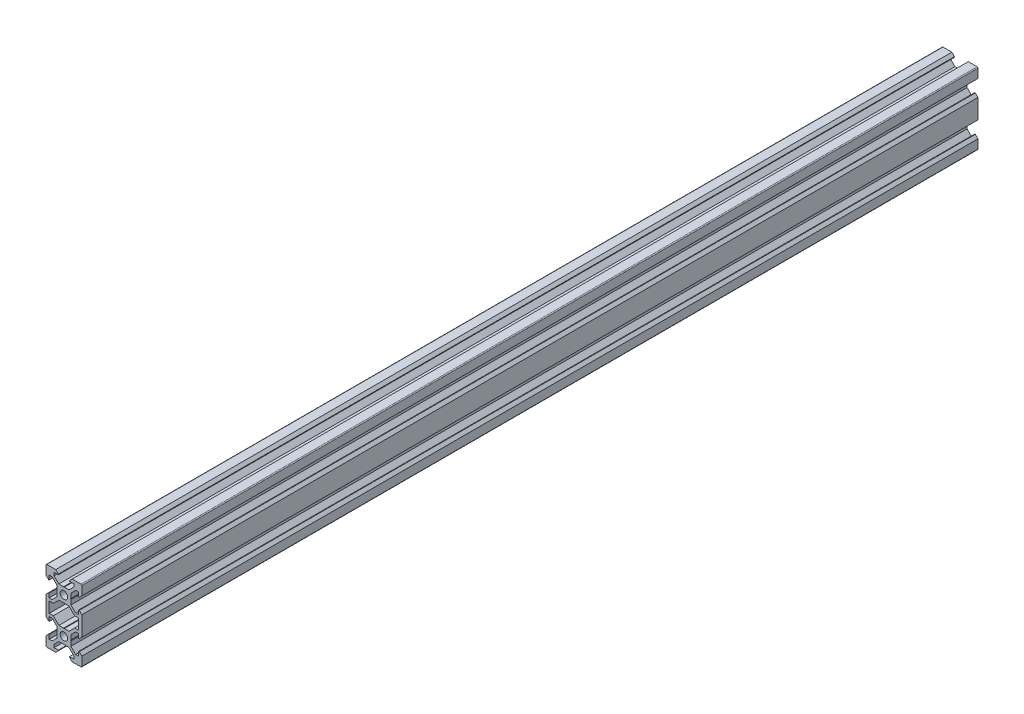
from build123d import *

# Parameters (mm, degrees)
SKETCH1_R           = 2.1
BOSS_EXTRUDE1_DEPTH = 500
FILLET1_R           = 0.5


with BuildPart() as part:
    # Sketch1 → Boss-Extrude1 (new body)
    with BuildSketch(Plane.XY):
        Polygon((2.839339828, 13.9), (5.5, 16.560660172), (5.5, 18.2), (3.125, 18.2), (3.125, 18.545), (4.58, 20), (10, 20), (10, 14.58), (8.545, 13.125), (8.2, 13.125), (8.2, 15.5), (6.560660172, 15.5), (3.9, 12.839339828), (3.9, 10.2), (3.7, 10), (3.9, 9.8), (3.9, 7.160660172), (6.560660172, 4.5), (8.2, 4.5), (8.2, 6.875), (8.545, 6.875), (10, 5.42), (10, -5.42), (8.545, -6.875), (8.2, -6.875), (8.2, -4.5), (6.560660172, -4.5), (3.9, -7.160660172), (3.9, -9.8), (3.7, -10), (3.9, -10.2), (3.9, -12.839339828), (6.560660172, -15.5), (8.2, -15.5), (8.2, -13.125), (8.545, -13.125), (10, -14.58), (10, -20), (4.58, -20), (3.125, -18.545), (3.125, -18.2), (5.5, -18.2), (5.5, -16.560660172), (2.839339828, -13.9), (0.2, -13.9), (0, -13.7), (-0.2, -13.9), (-2.839339828, -13.9), (-5.5, -16.560660172), (-5.5, -18.2), (-3.125, -18.2), (-3.125, -18.545), (-4.58, -20), (-10, -20), (-10, -14.58), (-8.545, -13.125), (-8.2, -13.125), (-8.2, -15.5), (-6.560660172, -15.5), (-3.9, -12.839339828), (-3.9, -10.2), (-3.7, -10), (-3.9, -9.8), (-3.9, -7.160660172), (-6.560660172, -4.5), (-8.2, -4.5), (-8.2, -6.875), (-8.545, -6.875), (-10, -5.42), (-10, 5.42), (-8.545, 6.875), (-8.2, 6.875), (-8.2, 4.5), (-6.560660172, 4.5), (-3.9, 7.160660172), (-3.9, 9.8), (-3.7, 10), (-3.9, 10.2), (-3.9, 12.839339828), (-6.560660172, 15.5), (-8.2, 15.5), (-8.2, 13.125), (-8.545, 13.125), (-10, 14.58), (-10, 20), (-4.58, 20), (-3.125, 18.545), (-3.125, 18.2), (-5.5, 18.2), (-5.5, 16.560660172), (-2.839339828, 13.9), (-0.2, 13.9), (0, 13.7), (0.2, 13.9), align=None)
        with Locations((0, 10)):
            Circle(SKETCH1_R, mode=Mode.SUBTRACT)
        with Locations((0, -10)):
            Circle(SKETCH1_R, mode=Mode.SUBTRACT)
        Polygon((8.2, -3), (8.2, 3), (5.939339828, 3), (2.839339828, 6.1), (0.2, 6.1), (0, 6.3), (-0.2, 6.1), (-2.839339828, 6.1), (-5.939339828, 3), (-8.2, 3), (-8.2, -3), (-5.939339828, -3), (-2.839339828, -6.1), (-0.2, -6.1), (0, -6.3), (0.2, -6.1), (2.839339828, -6.1), (5.939339828, -3), align=None, mode=Mode.SUBTRACT)
    extrude(amount=BOSS_EXTRUDE1_DEPTH)

    # Fillet1
    fillet1_edges = [part.edges().sort_by_distance(p)[0] for p in [
        (10, -20, 250),
        (-10, -20, 250),
        (-10, 20, 250),
        (10, 20, 250),
    ]]
    fillet(fillet1_edges, radius=FILLET1_R)


solid = part.part
